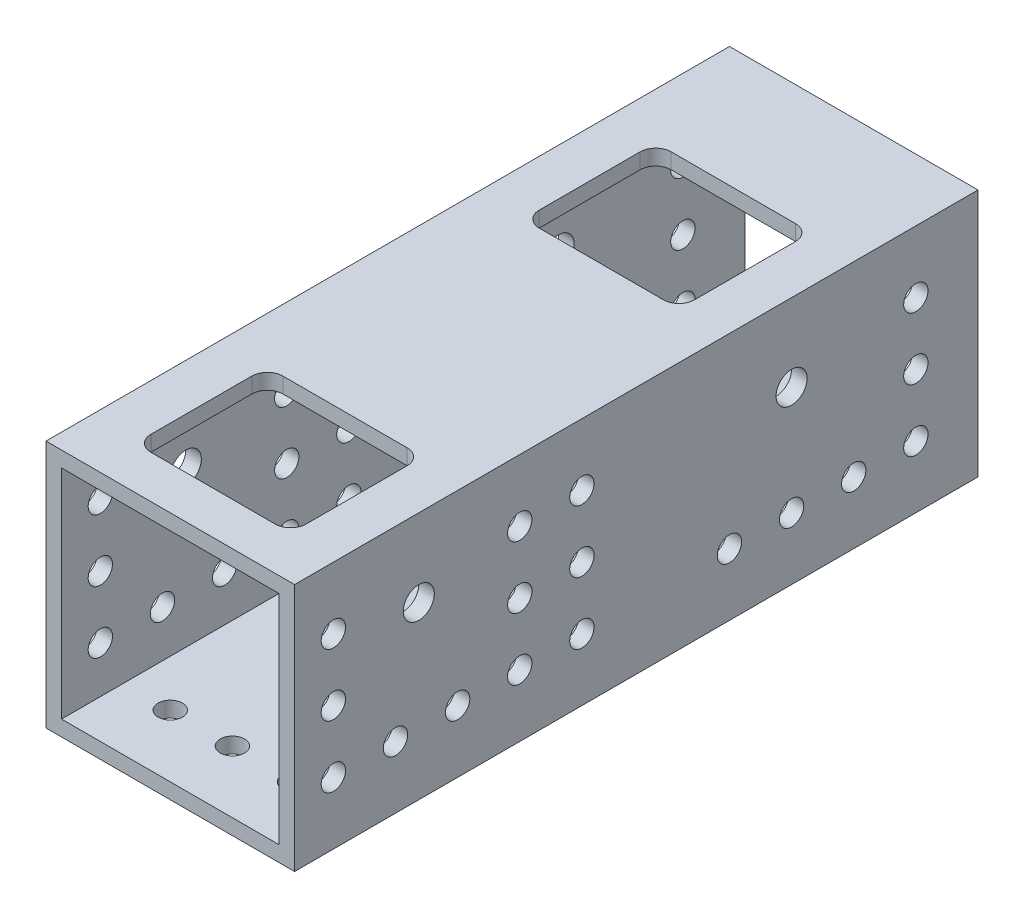
from build123d import *

# Parameters (mm, degrees)
SKETCH1_W               = 50.8
SKETCH1_H               = 50.8
BOSS_EXTRUDE1_DEPTH     = 69.85
SHELL1_T                = -3.175
SKETCH2_W               = 31.75
SKETCH2_H               = 26.9875
CUT_EXTRUDE1_DEPTH      = 79.545162168
FILLET1_R               = 3.175
CUT_EXTRUDE2_DEPTH      = 79.545162168
CUT_EXTRUDE2_DEPTH_BACK = 79.545162168
SKETCH3_R               = 3.175
CUT_EXTRUDE3_DEPTH      = 79.545162168
CUT_EXTRUDE3_DEPTH_BACK = 79.545162168
SKETCH4_R               = 2.4892
CUT_EXTRUDE4_DEPTH      = 79.545162168
CUT_EXTRUDE4_DEPTH_BACK = 79.545162168
SKETCH5_R               = 2.4892
FILLET2_R               = 3.175


with BuildPart() as part:
    # Sketch1 → Boss-Extrude1 (new, symmetric)
    with BuildSketch(Plane.XY):
        Rectangle(SKETCH1_W, SKETCH1_H)
    extrude(amount=BOSS_EXTRUDE1_DEPTH, both=True)

    # Shell1
    shell1_openings = [part.faces().sort_by_distance(p)[0] for p in [
        (0, 0, 69.85),
        (0, 0, -69.85),
    ]]
    offset(amount=SHELL1_T, openings=shell1_openings, kind=Kind.INTERSECTION)

    # Sketch2 → Cut-Extrude1 (cut, through all)
    with BuildSketch(Plane(origin=(0, 0, 0), x_dir=(1, 0, 0), z_dir=(0, 1, 0))):
        with Locations((0, 31.75)):
            Rectangle(SKETCH2_W, SKETCH2_H)
        with Locations((0, -47.625)):
            Rectangle(SKETCH2_W, SKETCH2_H)
    extrude(amount=CUT_EXTRUDE1_DEPTH, mode=Mode.SUBTRACT)

    # Fillet1
    fillet1_edges = [part.edges().sort_by_distance(p)[0] for p in [
        (15.875, 23.8125, -18.25625),
        (15.875, 23.8125, -45.24375),
        (-15.875, 23.8125, -45.24375),
        (-15.875, 23.8125, -18.25625),
    ]]
    fillet(fillet1_edges, radius=FILLET1_R)

    # Sketch3 → Cut-Extrude2 (cut, two sides: drawn at the far end of the back side and taken through both)
    with BuildSketch(Plane(origin=(0, 0, 0), x_dir=(0, 0, -1), z_dir=(1, 0, 0)).offset(-CUT_EXTRUDE2_DEPTH_BACK)):
        with Locations((31.75, 9.525)):
            Circle(SKETCH3_R)
        with Locations((-44.45, 9.525)):
            Circle(SKETCH3_R)
    extrude(amount=CUT_EXTRUDE2_DEPTH + CUT_EXTRUDE2_DEPTH_BACK, mode=Mode.SUBTRACT)

    # Sketch4 → Cut-Extrude3 (cut, two sides: drawn at the far end of the back side and taken through both)
    with BuildSketch(Plane(origin=(0, 0, 0), x_dir=(0, 0, -1), z_dir=(1, 0, 0)).offset(-CUT_EXTRUDE3_DEPTH_BACK)):
        with Locations((57.15, 12.7)):
            Circle(SKETCH4_R)
        with Locations((44.45, -12.7)):
            Circle(SKETCH4_R)
        with Locations((31.75, -12.7)):
            Circle(SKETCH4_R)
        with Locations((19.05, -12.7)):
            Circle(SKETCH4_R)
        with Locations((57.15, 0)):
            Circle(SKETCH4_R)
        with Locations((57.15, -12.7)):
            Circle(SKETCH4_R)
        with Locations((-61.9125, 12.7)):
            Circle(SKETCH4_R)
        with Locations((-23.8125, 12.7)):
            Circle(SKETCH4_R)
        with Locations((-11.1125, 12.7)):
            Circle(SKETCH4_R)
        with Locations((-23.8125, 0)):
            Circle(SKETCH4_R)
        with Locations((-11.1125, 0)):
            Circle(SKETCH4_R)
        with Locations((-49.2125, -12.7)):
            Circle(SKETCH4_R)
        with Locations((-36.5125, -12.7)):
            Circle(SKETCH4_R)
        with Locations((-23.8125, -12.7)):
            Circle(SKETCH4_R)
        with Locations((-11.1125, -12.7)):
            Circle(SKETCH4_R)
        with Locations((-61.9125, 0)):
            Circle(SKETCH4_R)
        with Locations((-61.9125, -12.7)):
            Circle(SKETCH4_R)
    extrude(amount=CUT_EXTRUDE3_DEPTH + CUT_EXTRUDE3_DEPTH_BACK, mode=Mode.SUBTRACT)

    # Sketch5 → Cut-Extrude4 (cut, two sides: drawn at the far end of the back side and taken through both)
    with BuildSketch(Plane(origin=(0, 0, 0), x_dir=(1, 0, 0), z_dir=(0, 1, 0)).offset(-CUT_EXTRUDE4_DEPTH_BACK)):
        with Locations(Location((-12.7, -57.15, 0), (0, 0, 270))):
            Circle(SKETCH5_R)
        with Locations(Location((0, -57.15, 0), (0, 0, 270))):
            Circle(SKETCH5_R)
        with Locations(Location((12.7, -57.15, 0), (0, 0, 270))):
            Circle(SKETCH5_R)
    extrude(amount=CUT_EXTRUDE4_DEPTH + CUT_EXTRUDE4_DEPTH_BACK, mode=Mode.SUBTRACT)

    # Fillet2
    fillet2_edges = [part.edges().sort_by_distance(p)[0] for p in [
        (15.875, 23.8125, 61.11875),
        (15.875, 23.8125, 34.13125),
        (-15.875, 23.8125, 34.13125),
        (-15.875, 23.8125, 61.11875),
    ]]
    fillet(fillet2_edges, radius=FILLET2_R)


solid = part.part
